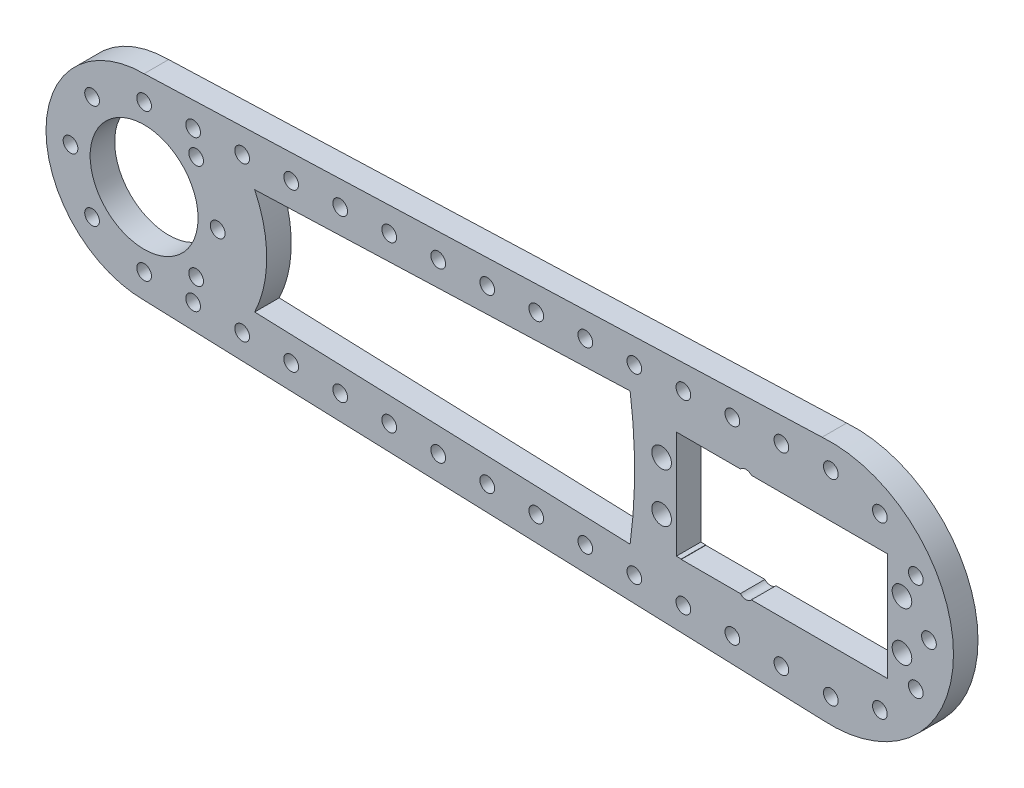
from build123d import *
from build123d.topology import SkipClean

# Parameters (mm, degrees)
EXTRUDE_3_DEPTH      = 5
SKETCH_4_R           = 4
SKETCH_4_R_2         = 1.5
CUT_EXTRUDE_3_DEPTH  = 5
SKETCH_5_R           = 11
CUT_EXTRUDE_4_DEPTH  = 2
SKETCH_6_R           = 1.5
CUT_EXTRUDE_6_DEPTH  = 169.745370307
SKETCH_7_R           = 1.5
CUT_EXTRUDE_7_DEPTH  = 10
SKETCH_8_R           = 11
CUT_EXTRUDE_8_DEPTH  = 10
SKETCH_9_R           = 1.5
CUT_EXTRUDE_9_DEPTH  = 10
SKETCH_10_R          = 5
CUT_EXTRUDE_10_DEPTH = 10
SKETCH_11_R          = 2
CUT_EXTRUDE_11_DEPTH = 10
SKETCH_12_W          = 41
SKETCH_12_H          = 22
CUT_EXTRUDE_12_DEPTH = 10
SKETCH_13_R          = 1.5
CUT_EXTRUDE_13_DEPTH = 10
EXTRUDE_4_DEPTH      = 5
SKETCH_15_R          = 1.5
EXTRUDE_6_DEPTH      = 5
SKETCH_16_R          = 1.5
CUT_EXTRUDE_14_DEPTH = 5
EXTRUDE_7_DEPTH      = 5
CUT_EXTRUDE_15_DEPTH = 5
SKETCH_19_W          = 1
SKETCH_19_H          = 21.932218182
SKETCH_19_H_2        = 22
CUT_EXTRUDE_16_DEPTH = 10


with BuildPart() as part:
    # 草图1 → 凸台-拉伸3 (new body)
    with BuildSketch(Plane.XY):
        with BuildLine():
            Line((140, 25), (0, 35))
            ThreePointArc((0, 35), (-35, 0), (0, -35))
            Line((0, -35), (140, -25))
            ThreePointArc((140, -25), (165, 0), (140, 25))
        make_face()
    extrude(amount=EXTRUDE_3_DEPTH)

    # 草图4 → 切除-拉伸3 (cut)
    with BuildSketch(Plane.XY.offset(5)):
        with Locations((140, 0)):
            Circle(SKETCH_4_R)
        Circle(SKETCH_4_R)
        with BuildLine():
            Line((-5, -3.5), (-5, -5))
            Line((-5, -5), (-3.5, -5))
            ThreePointArc((-3.5, -5), (-3.939339828, -3.939339828), (-5, -3.5))
        make_face()
        with BuildLine():
            Line((-3.5, -5), (-5, -5))
            Line((-5, -5), (-5, -3.5))
            ThreePointArc((-5, -3.5), (-6.060660172, -6.060660172), (-3.5, -5))
        make_face()
        with Locations((135, 5)):
            Circle(SKETCH_4_R_2)
        with Locations((135, -5)):
            Circle(SKETCH_4_R_2)
        with Locations((145, -5)):
            Circle(SKETCH_4_R_2)
        with Locations((145, 5)):
            Circle(SKETCH_4_R_2)
        with Locations((-5, 5)):
            Circle(SKETCH_4_R_2)
        with Locations((5, 5)):
            Circle(SKETCH_4_R_2)
        with Locations((5, -5)):
            Circle(SKETCH_4_R_2)
    extrude(amount=-CUT_EXTRUDE_3_DEPTH, mode=Mode.SUBTRACT)

    # 草图5 → 切除-拉伸4 (cut)
    with BuildSketch(Plane.XY.offset(5)):
        Circle(SKETCH_5_R)
        with Locations((140, 0)):
            Circle(SKETCH_5_R)
    extrude(amount=-CUT_EXTRUDE_4_DEPTH, mode=Mode.SUBTRACT)

    # 草图6 → 切除-拉伸6 (cut, through all)
    with BuildSketch(Plane.XY.offset(5)):
        with Locations((0, 30)):
            Circle(SKETCH_6_R)
        with Locations((15, 25.980762114)):
            Circle(SKETCH_6_R)
        with Locations((25.980762114, 15)):
            Circle(SKETCH_6_R)
        with Locations((30, 0)):
            Circle(SKETCH_6_R)
        with Locations((25.980762114, -15)):
            Circle(SKETCH_6_R)
        with Locations((15, -25.980762114)):
            Circle(SKETCH_6_R)
        with Locations((0, -30)):
            Circle(SKETCH_6_R)
        with Locations((-15, -25.980762114)):
            Circle(SKETCH_6_R)
        with Locations((-25.980762114, -15)):
            Circle(SKETCH_6_R)
        with Locations((-30, 0)):
            Circle(SKETCH_6_R)
        with Locations((-25.980762114, 15)):
            Circle(SKETCH_6_R)
        with Locations((-15, 25.980762114)):
            Circle(SKETCH_6_R)
        with Locations((140, 20)):
            Circle(SKETCH_6_R)
        with Locations((150, 17.320508076)):
            Circle(SKETCH_6_R)
        with Locations((157.320508076, 10)):
            Circle(SKETCH_6_R)
        with Locations((160, 0)):
            Circle(SKETCH_6_R)
        with Locations((157.320508076, -10)):
            Circle(SKETCH_6_R)
        with Locations((150, -17.320508076)):
            Circle(SKETCH_6_R)
        with Locations((140, -20)):
            Circle(SKETCH_6_R)
        with Locations((130, -17.320508076)):
            Circle(SKETCH_6_R)
        with Locations((122.679491924, -10)):
            Circle(SKETCH_6_R)
        with Locations((120, 0)):
            Circle(SKETCH_6_R)
        with Locations((122.679491924, 10)):
            Circle(SKETCH_6_R)
        with Locations((130, 17.320508076)):
            Circle(SKETCH_6_R)
    extrude(amount=-CUT_EXTRUDE_6_DEPTH, mode=Mode.SUBTRACT)

    # 草图7 → 切除-拉伸7 (cut)
    with SkipClean():  # the faces are left unmerged after this step: merging them gives an invalid solid
        with BuildSketch(Plane.XY.offset(5)):
            with BuildLine():
                ThreePointArc((138.21656051, 24.936305732), (139.107711737, 24.984071359), (140, 25))
                Line((140, 25), (0, 35))
                ThreePointArc((0, 35), (-35, 0), (0, -35))
                Line((0, -35), (140, -25))
                ThreePointArc((140, -25), (139.107711737, -24.984071359), (138.21656051, -24.936305732))
                Line((138.21656051, -24.936305732), (0, -20))
                ThreePointArc((0, -20), (-20, 0), (0, 20))
                Line((0, 20), (138.21656051, 24.936305732))
            make_face()
            with Locations((0, -30)):
                Circle(SKETCH_7_R, mode=Mode.SUBTRACT)
            with Locations((-15, -25.980762114)):
                Circle(SKETCH_7_R, mode=Mode.SUBTRACT)
            with Locations((15, -25.980762114)):
                Circle(SKETCH_7_R, mode=Mode.SUBTRACT)
            with Locations((-25.980762114, -15)):
                Circle(SKETCH_7_R, mode=Mode.SUBTRACT)
            with Locations((-30, 0)):
                Circle(SKETCH_7_R, mode=Mode.SUBTRACT)
            with Locations((-25.980762114, 15)):
                Circle(SKETCH_7_R, mode=Mode.SUBTRACT)
            with Locations((-15, 25.980762114)):
                Circle(SKETCH_7_R, mode=Mode.SUBTRACT)
            with Locations((0, 30)):
                Circle(SKETCH_7_R, mode=Mode.SUBTRACT)
            with Locations((15, 25.980762114)):
                Circle(SKETCH_7_R, mode=Mode.SUBTRACT)
        extrude(amount=-CUT_EXTRUDE_7_DEPTH, mode=Mode.SUBTRACT)

    # 草图8 → 切除-拉伸8 (cut)
    with SkipClean():  # the faces are left unmerged after this step: merging them gives an invalid solid
        with BuildSketch(Plane.XY.offset(5)):
            Circle(SKETCH_8_R)
        extrude(amount=-CUT_EXTRUDE_8_DEPTH, mode=Mode.SUBTRACT)

    # 草图9 → 切除-拉伸9 (cut)
    with SkipClean():  # the faces are left unmerged after this step: merging them gives an invalid solid
        with BuildSketch(Plane.XY.offset(5)):
            with Locations((0, 15)):
                Circle(SKETCH_9_R)
            with Locations((10.606601718, 10.606601718)):
                Circle(SKETCH_9_R)
            with Locations((15, 0)):
                Circle(SKETCH_9_R)
            with Locations((10.606601718, -10.606601718)):
                Circle(SKETCH_9_R)
            with Locations((0, -15)):
                Circle(SKETCH_9_R)
            with Locations((-10.606601718, -10.606601718)):
                Circle(SKETCH_9_R)
            with Locations((-15, 0)):
                Circle(SKETCH_9_R)
            with Locations((-10.606601718, 10.606601718)):
                Circle(SKETCH_9_R)
        extrude(amount=-CUT_EXTRUDE_9_DEPTH, mode=Mode.SUBTRACT)

    # 草图10 → 切除-拉伸10 (cut)
    with SkipClean():  # the faces are left unmerged after this step: merging them gives an invalid solid
        with BuildSketch(Plane.XY.offset(3)):
            with Locations((140, 0)):
                Circle(SKETCH_10_R)
        extrude(amount=-CUT_EXTRUDE_10_DEPTH, mode=Mode.SUBTRACT)

    # 草图11 → 切除-拉伸11 (cut)
    with SkipClean():  # the faces are left unmerged after this step: merging them gives an invalid solid
        with BuildSketch(Plane.XY.offset(5)):
            with Locations((105.5, 5)):
                Circle(SKETCH_11_R)
            Polygon((110, 10), (110, 0), (110, -10), (150, -10), (150, 10), align=None)
            with Locations((105.5, -5)):
                Circle(SKETCH_11_R)
            with Locations((154.5, -5)):
                Circle(SKETCH_11_R)
            with Locations((154.5, 5)):
                Circle(SKETCH_11_R)
        extrude(amount=-CUT_EXTRUDE_11_DEPTH, mode=Mode.SUBTRACT)

    # 草图12 → 切除-拉伸12 (cut)
    with SkipClean():  # the faces are left unmerged after this step: merging them gives an invalid solid
        with BuildSketch(Plane.XY.offset(5)):
            with Locations((130, 0)):
                Rectangle(SKETCH_12_W, SKETCH_12_H)
        extrude(amount=-CUT_EXTRUDE_12_DEPTH, mode=Mode.SUBTRACT)

    # 草图13 → 切除-拉伸13 (cut)
    with SkipClean():  # the faces are left unmerged after this step: merging them gives an invalid solid
        with BuildSketch(Plane.XY.offset(5)):
            with BuildLine():
                ThreePointArc((11.493628543, -15.356915305), (10.021994052, -13.85718353), (8.494701346, -15.300194432))
                Line((8.494701346, -15.300194432), (11.492783148, -15.407268782))
                ThreePointArc((11.492783148, -15.407268782), (11.49341718, -15.382095592), (11.493628543, -15.356915305))
            make_face()
            with BuildLine():
                Line((11.492783148, -15.407268782), (8.494701346, -15.300194432))
                ThreePointArc((8.494701346, -15.300194432), (9.940091248, -16.855959587), (11.492783148, -15.407268782))
            make_face()
            with BuildLine():
                Line((131.416325669, -19.690252443), (128.418243868, -19.583178093))
                ThreePointArc((128.418243868, -19.583178093), (129.863633769, -21.138943248), (131.416325669, -19.690252443))
            make_face()
            with BuildLine():
                ThreePointArc((129.008722028, -18.446282468), (128.586006913, -18.948522079), (128.418243868, -19.583178093))
                Line((128.418243868, -19.583178093), (131.416325669, -19.690252443))
                ThreePointArc((131.416325669, -19.690252443), (131.416959701, -19.665079253), (131.417171065, -19.639898967))
                ThreePointArc((131.417171065, -19.639898967), (131.284086746, -19.022208493), (130.908449037, -18.514124575))
                ThreePointArc((130.908449037, -18.514124575), (129.94646687, -18.819552506), (129.008722028, -18.446282468))
            make_face()
            with Locations((19.987257087, -15.71383061)):
                Circle(SKETCH_13_R)
            with Locations((29.98088563, -16.070745915)):
                Circle(SKETCH_13_R)
            with Locations((39.974514174, -16.42766122)):
                Circle(SKETCH_13_R)
            with Locations((49.968142717, -16.784576526)):
                Circle(SKETCH_13_R)
            with Locations((59.961771261, -17.141491831)):
                Circle(SKETCH_13_R)
            with Locations((69.955399804, -17.498407136)):
                Circle(SKETCH_13_R)
            with Locations((89.942656891, -18.212237746)):
                Circle(SKETCH_13_R)
            with Locations((79.949028348, -17.855322441)):
                Circle(SKETCH_13_R)
            with Locations((99.936285435, -18.569153051)):
                Circle(SKETCH_13_R)
            with Locations((109.929913978, -18.926068356)):
                Circle(SKETCH_13_R)
            with Locations((119.923542522, -19.282983661)):
                Circle(SKETCH_13_R)
        extrude(amount=-CUT_EXTRUDE_13_DEPTH, mode=Mode.SUBTRACT)

    # 草图14 → 凸台-拉伸4 (add)
    with SkipClean():  # the faces are left unmerged after this step: merging them gives an invalid solid
        with BuildSketch(Plane.XY.offset(5)):
            with BuildLine():
                ThreePointArc((130.908449037, -18.514124575), (131.344000289, -17.986588568), (131.5, -17.320508076))
                ThreePointArc((131.5, -17.320508076), (129.382309527, -15.953592395), (129.008722028, -18.446282468))
                ThreePointArc((129.008722028, -18.446282468), (129.970704195, -18.140854536), (130.908449037, -18.514124575))
            make_face()
        extrude(amount=-EXTRUDE_4_DEPTH)

    # 草图15 → 凸台-拉伸6 (add)
    with SkipClean():  # the faces are left unmerged after this step: merging them gives an invalid solid
        with BuildSketch(Plane.XY.offset(5)):
            with Locations((25.980762114, 15)):
                Circle(SKETCH_15_R)
            with Locations((30, 0)):
                Circle(SKETCH_15_R)
            with Locations((25.980762114, -15)):
                Circle(SKETCH_15_R)
        extrude(amount=-EXTRUDE_6_DEPTH)

    # 草图16 → 切除-拉伸14 (cut)
    with SkipClean():  # the faces are left unmerged after this step: merging them gives an invalid solid
        with BuildSketch(Plane.XY.offset(5)):
            with BuildLine():
                ThreePointArc((51.467297322, 16.834930002), (49.914605422, 18.283620807), (48.46921552, 16.727855652))
                Line((48.46921552, 16.727855652), (51.467297322, 16.834930002))
            make_face()
            with BuildLine():
                Line((51.467297322, 16.834930002), (48.46921552, 16.727855652))
                ThreePointArc((48.46921552, 16.727855652), (49.996508226, 15.28484475), (51.468142717, 16.784576526))
                ThreePointArc((51.468142717, 16.784576526), (51.467931354, 16.809756812), (51.467297322, 16.834930002))
            make_face()
            with BuildLine():
                ThreePointArc((61.460925865, 17.191845307), (59.908233965, 18.640536112), (58.462844064, 17.084770957))
                Line((58.462844064, 17.084770957), (61.460925865, 17.191845307))
            make_face()
            with BuildLine():
                Line((61.460925865, 17.191845307), (58.462844064, 17.084770957))
                ThreePointArc((58.462844064, 17.084770957), (59.99013677, 15.641760055), (61.461771261, 17.141491831))
                ThreePointArc((61.461771261, 17.141491831), (61.461559897, 17.166672117), (61.460925865, 17.191845307))
            make_face()
            with BuildLine():
                ThreePointArc((71.454554409, 17.548760612), (69.901862509, 18.997451417), (68.456472607, 17.441686262))
                Line((68.456472607, 17.441686262), (71.454554409, 17.548760612))
            make_face()
            with BuildLine():
                Line((71.454554409, 17.548760612), (68.456472607, 17.441686262))
                ThreePointArc((68.456472607, 17.441686262), (69.983765313, 15.998675361), (71.455399804, 17.498407136))
                ThreePointArc((71.455399804, 17.498407136), (71.45518844, 17.523587422), (71.454554409, 17.548760612))
            make_face()
            with Locations((9.993628543, 15.356915305)):
                Circle(SKETCH_16_R)
            with Locations((19.987257087, 15.71383061)):
                Circle(SKETCH_16_R)
            with Locations((29.98088563, 16.070745915)):
                Circle(SKETCH_16_R)
            with Locations((39.974514174, 16.42766122)):
                Circle(SKETCH_16_R)
            with Locations((79.949028348, 17.855322441)):
                Circle(SKETCH_16_R)
            with Locations((89.942656891, 18.212237746)):
                Circle(SKETCH_16_R)
            with Locations((99.936285435, 18.569153051)):
                Circle(SKETCH_16_R)
            with Locations((109.929913978, 18.926068356)):
                Circle(SKETCH_16_R)
            with Locations((119.923542522, 19.282983661)):
                Circle(SKETCH_16_R)
            with Locations((129.917171065, 19.639898967)):
                Circle(SKETCH_16_R)
        extrude(amount=-CUT_EXTRUDE_14_DEPTH, mode=Mode.SUBTRACT)

    # 草图17 → 凸台-拉伸7 (add)
    with SkipClean():  # the faces are left unmerged after this step: merging them gives an invalid solid
        with BuildSketch(Plane.XY.offset(5)):
            with BuildLine():
                ThreePointArc((129.008722028, 18.446282468), (129.382309527, 15.953592395), (131.5, 17.320508076))
                ThreePointArc((131.5, 17.320508076), (131.344000289, 17.986588568), (130.908449037, 18.514124575))
                ThreePointArc((130.908449037, 18.514124575), (129.970704195, 18.140854536), (129.008722028, 18.446282468))
            make_face()
        extrude(amount=-EXTRUDE_7_DEPTH)

    # 草图18 → 切除-拉伸15 (cut)
    with SkipClean():  # the faces are left unmerged after this step: merging them gives an invalid solid
        with BuildSketch(Plane.XY.offset(5)):
            with BuildLine():
                ThreePointArc((100, 0), (99.769776761, 6.781714021), (99.080167099, 13.532201878))
                Line((99.080167099, 13.532201878), (22.547372848, 10.798887797))
                ThreePointArc((22.547372848, 10.798887797), (24.379133713, 5.536952176), (25, 0))
                ThreePointArc((25, 0), (24.379133713, -5.536952176), (22.547372848, -10.798887797))
                Line((22.547372848, -10.798887797), (99.080167099, -13.532201878))
                ThreePointArc((99.080167099, -13.532201878), (99.769776761, -6.781714021), (100, 0))
            make_face()
        extrude(amount=-CUT_EXTRUDE_15_DEPTH, mode=Mode.SUBTRACT)

    # 草图19 → 切除-拉伸16 (cut)
    with SkipClean():  # the faces are left unmerged after this step: merging them gives an invalid solid
        with BuildSketch(Plane.XY.offset(5)):
            with Locations((109, 0.033890909)):
                Rectangle(SKETCH_19_W, SKETCH_19_H)
            with Locations((151, 0)):
                Rectangle(SKETCH_19_W, SKETCH_19_H_2)
        extrude(amount=-CUT_EXTRUDE_16_DEPTH, mode=Mode.SUBTRACT)


solid = part.part
